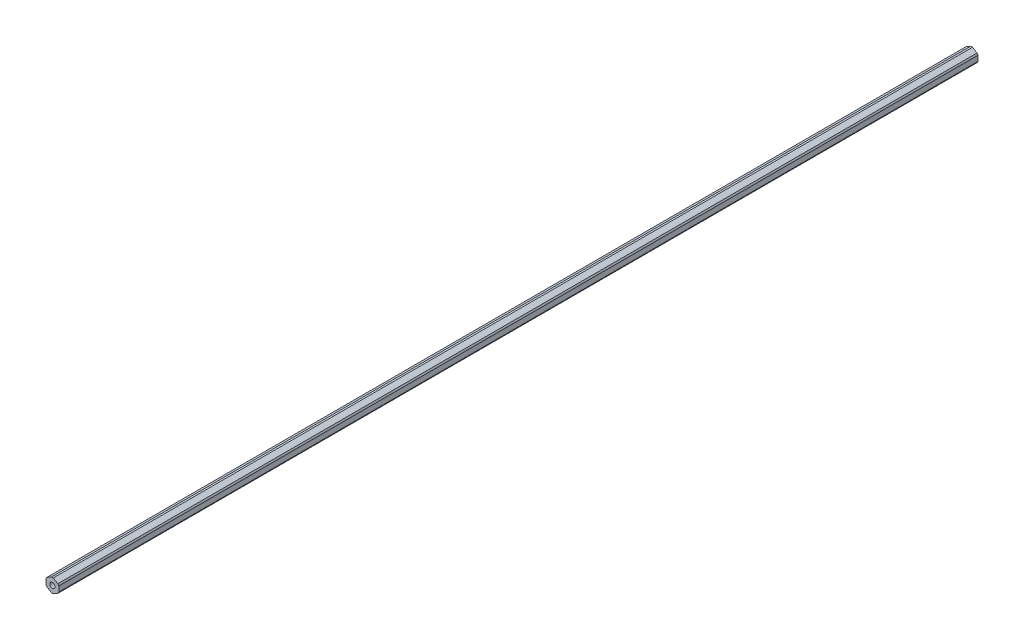
from build123d import *

# Parameters (mm, degrees)
SHAFT_BOSS_DEPTH                = 914.4
SKETCH2_R                       = 9.41705
SKETCH2_R_2                     = 6.87705
CUT_FOR_THUNDER_HEX_ROUND_DEPTH = 914.4
SKETCH3_R                       = 2.5527
CENTER_HOLE_CUT_DEPTH           = 914.4


with BuildPart() as part:
    # Sketch1 → Shaft Boss (new body)
    with BuildSketch(Plane.XY):
        Polygon((0, 7.332348419), (-6.35, 3.666174209), (-6.35, -3.666174209), (0, -7.332348419), (6.35, -3.666174209), (6.35, 3.666174209), align=None)
    extrude(amount=SHAFT_BOSS_DEPTH)

    # Sketch2 → Cut For Thunder Hex Round (cut)
    with BuildSketch(Plane(origin=(0, 0, 0), x_dir=(-1, 0, 0), z_dir=(0, 0, -1))):
        Circle(SKETCH2_R)
        Circle(SKETCH2_R_2, mode=Mode.SUBTRACT)
    extrude(amount=-CUT_FOR_THUNDER_HEX_ROUND_DEPTH, mode=Mode.SUBTRACT)

    # Sketch3 → Center Hole Cut (cut)
    with BuildSketch(Plane(origin=(0, 0, 0), x_dir=(-1, 0, 0), z_dir=(0, 0, -1))):
        Circle(SKETCH3_R)
    extrude(amount=-CENTER_HOLE_CUT_DEPTH, mode=Mode.SUBTRACT)


solid = part.part
